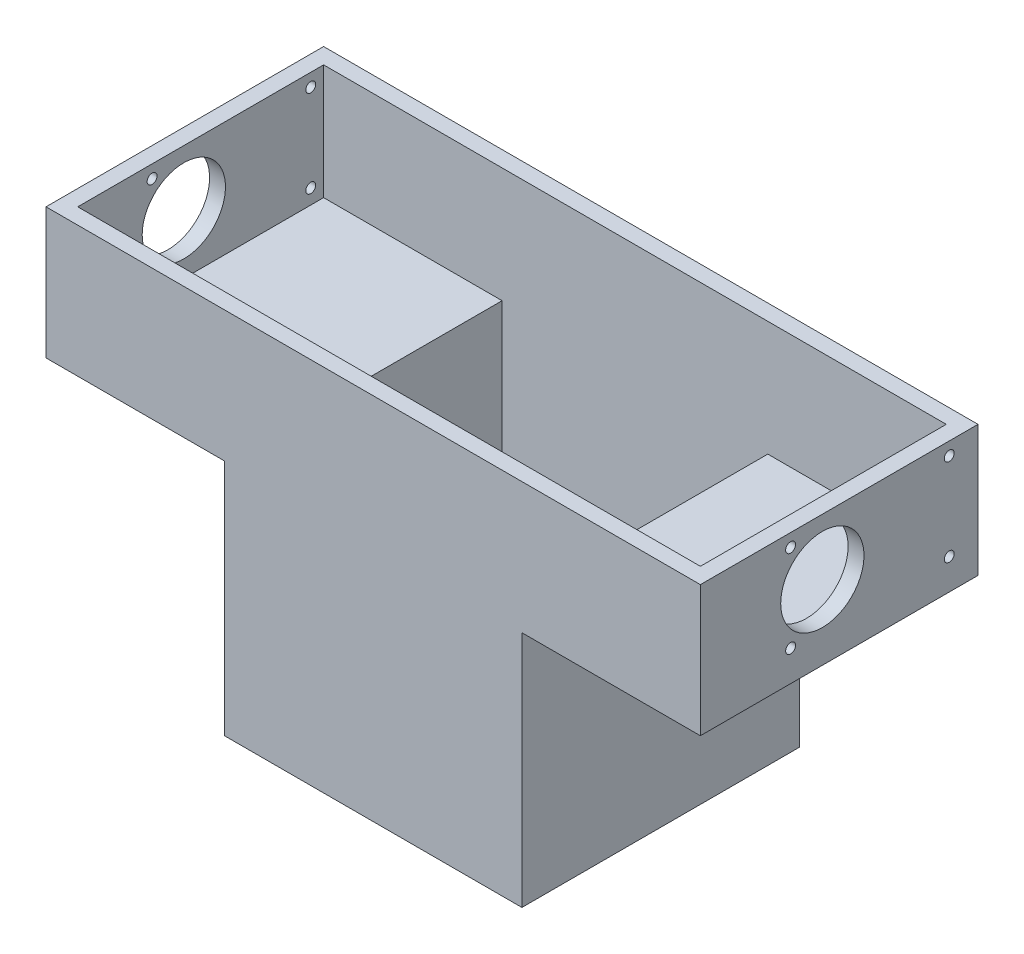
from build123d import *

# Parameters (mm, degrees)
SKETCH1_W                = 75
SKETCH1_H                = 40
SKETCH1_R                = 5
SKETCH1_R_2              = 1.7
SKETCH1_R_3              = 1.197563381
SKETCH1_W_2              = 5
SKETCH1_H_2              = 20
BOSS_EXTRUDE1_DEPTH      = 3
CUT_EXTRUDE1_DEPTH       = 43.605750786
CUT_EXTRUDE1_DEPTH_BACK  = 43.605750786
SKETCH2_W                = 67
SKETCH2_H                = 28
BOSS_EXTRUDE3_DEPTH      = 90
BOSS_EXTRUDE3_DEPTH_BACK = 3
SKETCH6_W                = 67
SKETCH6_H                = 11
CUT_EXTRUDE4_DEPTH       = 104.591746776
SKETCH7_W                = 70
SKETCH7_H                = 37
BOSS_EXTRUDE4_DEPTH      = 45
SKETCH8_W                = 45
SKETCH8_H                = 62
CUT_EXTRUDE6_DEPTH       = 29
SKETCH9_R                = 1.25
SKETCH9_R_2              = 10.5
CUT_EXTRUDE8_DEPTH       = 193.611006954
SKETCH11_W               = 45
SKETCH11_H               = 4
CUT_EXTRUDE9_DEPTH       = 143.671826231


with BuildPart() as part:
    # Sketch1 → Boss-Extrude1 (new body)
    with BuildSketch(Plane(origin=(0, 0, 0), x_dir=(1, 0, 0), z_dir=(0, 1, 0))):
        Rectangle(SKETCH1_W, SKETCH1_H)
        with Locations(Location((-21, 0, 0), (0, 0, 270))):
            Circle(SKETCH1_R, mode=Mode.SUBTRACT)
        with Locations(Location((-30, 8.25, 0), (0, 0, 270))):
            Circle(SKETCH1_R_2, mode=Mode.SUBTRACT)
        with Locations(Location((-12, 8.25, 0), (0, 0, 270))):
            Circle(SKETCH1_R_2, mode=Mode.SUBTRACT)
        with Locations(Location((-12, -8.25, 0), (0, 0, 270))):
            Circle(SKETCH1_R_2, mode=Mode.SUBTRACT)
        with Locations(Location((-30, -8.25, 0), (0, 0, 270))):
            Circle(SKETCH1_R_2, mode=Mode.SUBTRACT)
        with Locations(Location((12, 8.25, 0), (0, 0, 90))):
            Circle(SKETCH1_R_2, mode=Mode.SUBTRACT)
        with Locations(Location((12, -8.25, 0), (0, 0, 90))):
            Circle(SKETCH1_R_2, mode=Mode.SUBTRACT)
        with Locations(Location((21, 0, 0), (0, 0, 90))):
            Circle(SKETCH1_R, mode=Mode.SUBTRACT)
        with Locations(Location((30, -8.25, 0), (0, 0, 90))):
            Circle(SKETCH1_R_2, mode=Mode.SUBTRACT)
        with Locations(Location((30, 8.25, 0), (0, 0, 90))):
            Circle(SKETCH1_R_2, mode=Mode.SUBTRACT)
        with Locations(Location((-30, -17.5, 0), (0, 0, 270))):
            Circle(SKETCH1_R_3, mode=Mode.SUBTRACT)
        with Locations(Location((-12, -17.5, 0), (0, 0, 270))):
            Circle(SKETCH1_R_3, mode=Mode.SUBTRACT)
        with Locations(Location((12, -17.5, 0), (0, 0, 90))):
            Circle(SKETCH1_R_3, mode=Mode.SUBTRACT)
        with Locations(Location((30, -17.5, 0), (0, 0, 90))):
            Circle(SKETCH1_R_3, mode=Mode.SUBTRACT)
        with Locations(Location((30, 17.5, 0), (0, 0, 270))):
            Circle(SKETCH1_R_3, mode=Mode.SUBTRACT)
        with Locations(Location((12, 17.5, 0), (0, 0, 270))):
            Circle(SKETCH1_R_3, mode=Mode.SUBTRACT)
        with Locations(Location((-12, 17.5, 0), (0, 0, 90))):
            Circle(SKETCH1_R_3, mode=Mode.SUBTRACT)
        with Locations(Location((-30, 17.5, 0), (0, 0, 90))):
            Circle(SKETCH1_R_3, mode=Mode.SUBTRACT)
        Rectangle(SKETCH1_W_2, SKETCH1_H_2, mode=Mode.SUBTRACT)
    extrude(amount=BOSS_EXTRUDE1_DEPTH)

    # Sketch2 → Cut-Extrude1 (cut, two sides: drawn at the far end of the back side and taken through both)
    with BuildSketch(Plane(origin=(0, 3, 0), x_dir=(1, 0, 0), z_dir=(0, 1, 0)).offset(-CUT_EXTRUDE1_DEPTH_BACK)):
        Rectangle(SKETCH2_W, SKETCH2_H)
    extrude(amount=CUT_EXTRUDE1_DEPTH + CUT_EXTRUDE1_DEPTH_BACK, mode=Mode.SUBTRACT)

    # Sketch3 → Boss-Extrude3 (add, two sides: drawn at the far end of the back side and taken through both)
    with BuildSketch(Plane(origin=(0, 3, 0), x_dir=(1, 0, 0), z_dir=(0, 1, 0)).offset(-BOSS_EXTRUDE3_DEPTH_BACK)):
        Polygon((37.5, -35), (37.5, -20), (33.5, -20), (-33.5, -20), (-37.5, -20), (-37.5, -35), align=None)
        Polygon((33.5, 20), (37.5, 20), (37.5, 35), (-37.5, 35), (-37.5, 20), (-33.5, 20), align=None)
        Polygon((37.5, -20), (37.5, 20), (33.5, 20), (33.5, 14), (33.5, -14), (33.5, -20), align=None)
        Polygon((-33.5, 14), (-33.5, 20), (-37.5, 20), (-37.5, -20), (-33.5, -20), (-33.5, -14), align=None)
    extrude(amount=BOSS_EXTRUDE3_DEPTH + BOSS_EXTRUDE3_DEPTH_BACK)

    # Sketch6 → Cut-Extrude4 (cut, through all)
    with BuildSketch(Plane(origin=(0, 3, 0), x_dir=(1, 0, 0), z_dir=(0, 1, 0))):
        with Locations((0, -25.5)):
            Rectangle(SKETCH6_W, SKETCH6_H)
        with Locations((0, 25.5)):
            Rectangle(SKETCH6_W, SKETCH6_H)
    extrude(amount=CUT_EXTRUDE4_DEPTH, mode=Mode.SUBTRACT)

    # Sketch7 → Boss-Extrude4 (add)
    with BuildSketch(Plane.ZY.offset(37.5)):
        with Locations((0, 74.5)):
            Rectangle(SKETCH7_W, SKETCH7_H)
    boss_extrude4 = extrude(amount=BOSS_EXTRUDE4_DEPTH)

    # Mirror2: Boss-Extrude4 across plane
    add(boss_extrude4.mirror(Plane(origin=(0, 0, 0), x_dir=(0, 0, 1), z_dir=(1, 0, 0))))

    # Sketch8 → Cut-Extrude6 (cut)
    with BuildSketch(Plane(origin=(0, 93, 0), x_dir=(1, 0, 0), z_dir=(0, 1, 0))):
        with Locations((-56, 0)):
            Rectangle(SKETCH8_W, SKETCH8_H)
        with Locations((56, 0)):
            Rectangle(SKETCH8_W, SKETCH8_H)
    extrude(amount=-CUT_EXTRUDE6_DEPTH, mode=Mode.SUBTRACT)

    # Sketch9 → Cut-Extrude8 (cut, through all)
    with BuildSketch(Plane.ZY.offset(82.5)):
        with Locations((-27.75, 89.75)):
            Circle(SKETCH9_R)
        with Locations((-27.75, 67.75)):
            Circle(SKETCH9_R)
        with Locations((4.25, 78.75)):
            Circle(SKETCH9_R_2)
        with Locations((12.25, 67.75)):
            Circle(SKETCH9_R)
        with Locations((12.25, 89.75)):
            Circle(SKETCH9_R)
    extrude(amount=-CUT_EXTRUDE8_DEPTH, mode=Mode.SUBTRACT)

    # Sketch11 → Cut-Extrude9 (cut, through all)
    with BuildSketch(Plane.XY.offset(35)):
        with Locations((-60, 58)):
            Rectangle(SKETCH11_W, SKETCH11_H)
        with Locations((60, 58)):
            Rectangle(SKETCH11_W, SKETCH11_H)
    extrude(amount=-CUT_EXTRUDE9_DEPTH, mode=Mode.SUBTRACT)


solid = part.part
